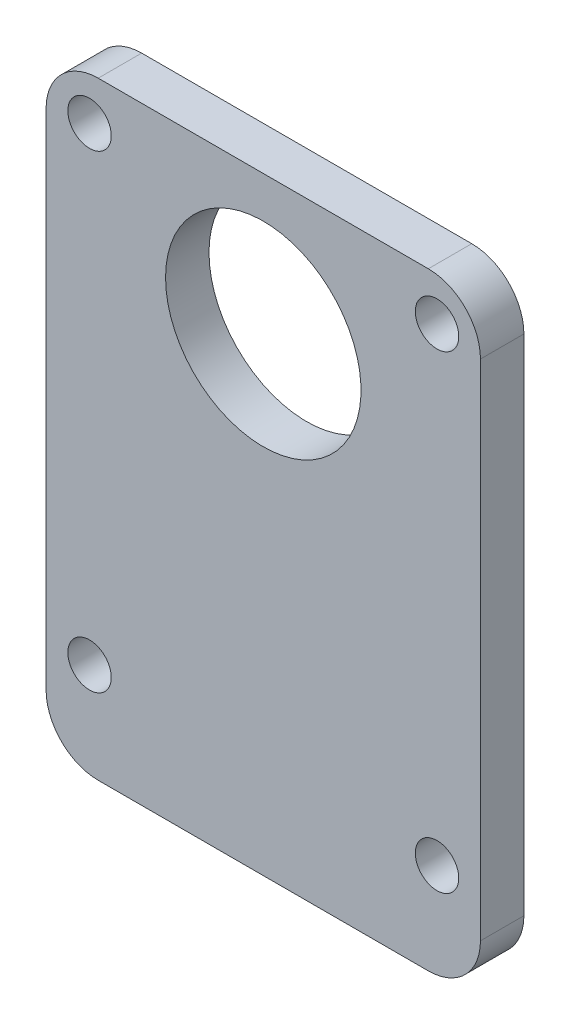
from build123d import *

# Parameters (mm, degrees)
BOSS_EXTRUDE1_DEPTH = 6.35
SKETCH2_R           = 1.35
SKETCH2_R_2         = 1.385
CUT_EXTRUDE1_DEPTH  = 38.116505762
SKETCH3_W           = 63.5
SKETCH3_H           = 88.9
SKETCH3_W_2         = 38.321076004
SKETCH3_H_2         = 47.237540142
BOSS_EXTRUDE2_DEPTH = 6.35
SKETCH5_W           = 27.94
SKETCH5_H           = 55.88
CUT_EXTRUDE3_DEPTH  = 61.153053743
SKETCH6_R           = 3.175
CUT_EXTRUDE4_DEPTH  = 61.153053743
FILLET2_R           = 7.62
SKETCH7_W           = 41.724968974
SKETCH7_H           = 57.858351452
BOSS_EXTRUDE3_DEPTH = 6.35
SKETCH8_R           = 14.2875
CUT_EXTRUDE5_DEPTH  = 6.35


with BuildPart() as part:
    # Sketch1 → Boss-Extrude1 (new body)
    with BuildSketch(Plane.XY):
        with BuildLine():
            Line((-19.69889026, 23.2987845), (-14.850045261, 29.75147823))
            ThreePointArc((-14.850045261, 29.75147823), (-14.144755454, 30.339267512), (-13.251155001, 30.55))
            Line((-13.251155001, 30.55), (13.251155001, 30.55))
            ThreePointArc((13.251155001, 30.55), (14.144755454, 30.339267512), (14.850045261, 29.75147823))
            Line((14.850045261, 29.75147823), (19.69889026, 23.2987845))
            ThreePointArc((19.69889026, 23.2987845), (19.997074131, 22.730638521), (20.1, 22.09730627))
            Line((20.1, 22.09730627), (20.1, -22.09730627))
            ThreePointArc((20.1, -22.09730627), (19.997074131, -22.730638521), (19.69889026, -23.2987845))
            Line((19.69889026, -23.2987845), (14.850045261, -29.75147823))
            ThreePointArc((14.850045261, -29.75147823), (14.144755454, -30.339267512), (13.251155001, -30.55))
            Line((13.251155001, -30.55), (-13.251155001, -30.55))
            ThreePointArc((-13.251155001, -30.55), (-14.144755454, -30.339267512), (-14.850045261, -29.75147823))
            Line((-14.850045261, -29.75147823), (-19.69889026, -23.2987845))
            ThreePointArc((-19.69889026, -23.2987845), (-19.997074131, -22.730638521), (-20.1, -22.09730627))
            Line((-20.1, -22.09730627), (-20.1, 22.09730627))
            ThreePointArc((-20.1, 22.09730627), (-19.997074131, 22.730638521), (-19.69889026, 23.2987845))
        make_face()
    extrude(amount=-BOSS_EXTRUDE1_DEPTH)

    # Sketch2 → Cut-Extrude1 (cut, through all)
    with BuildSketch(Plane(origin=(0, 0, -6.35), x_dir=(-1, 0, 0), z_dir=(0, 0, -1))):
        with Locations((17.3, 21.9487845)):
            Circle(SKETCH2_R)
        with Locations((17.3, -0.0512155)):
            Circle(SKETCH2_R)
        with Locations((17.3, -22.0512155)):
            Circle(SKETCH2_R)
        with Locations((11, -27.75)):
            Circle(SKETCH2_R_2)
        with Locations(Location((-11, -27.75, 0), (0, 0, 180))):
            Circle(SKETCH2_R_2)
        with Locations(Location((-17.3, -22.0512155, 0), (0, 0, 180))):
            Circle(SKETCH2_R)
        with Locations(Location((-17.3, -0.0512155, 0), (0, 0, 180))):
            Circle(SKETCH2_R)
        with Locations(Location((-17.3, 21.9487845, 0), (0, 0, 180))):
            Circle(SKETCH2_R)
    extrude(amount=-CUT_EXTRUDE1_DEPTH, mode=Mode.SUBTRACT)

    # Sketch3 → Boss-Extrude2 (add)
    with BuildSketch(Plane(origin=(0, 0, -6.35), x_dir=(-1, 0, 0), z_dir=(0, 0, -1))):
        with Locations((0, -6.2452155)):
            Rectangle(SKETCH3_W, SKETCH3_H)
        Rectangle(SKETCH3_W_2, SKETCH3_H_2, mode=Mode.SUBTRACT)
    extrude(amount=-BOSS_EXTRUDE2_DEPTH)

    # Sketch5 → Cut-Extrude3 (cut, through all)
    with BuildSketch(Plane.XY):
        with Locations((0, 3.0087845)):
            Rectangle(SKETCH5_W, SKETCH5_H)
    extrude(amount=-CUT_EXTRUDE3_DEPTH, mode=Mode.SUBTRACT)

    # Sketch6 → Cut-Extrude4 (cut, through all)
    with BuildSketch(Plane(origin=(0, 0, -6.35), x_dir=(-1, 0, 0), z_dir=(0, 0, -1))):
        with Locations((25.4, 31.8547845)):
            Circle(SKETCH6_R)
        with Locations((-25.4, 31.8547845)):
            Circle(SKETCH6_R)
        with Locations((-25.4, -36.7252155)):
            Circle(SKETCH6_R)
        with Locations((25.4, -36.7252155)):
            Circle(SKETCH6_R)
    extrude(amount=-CUT_EXTRUDE4_DEPTH, mode=Mode.SUBTRACT)

    # Fillet2
    fillet2_edges = [part.edges().sort_by_distance(p)[0] for p in [
        (-31.75, 38.2047845, -3.175),
        (-31.75, -50.6952155, -3.175),
        (31.75, -50.6952155, -3.175),
        (31.75, 38.2047845, -3.175),
    ]]
    fillet(fillet2_edges, radius=FILLET2_R)

    # Sketch7 → Boss-Extrude3 (add)
    with BuildSketch(Plane(origin=(0, 0, -6.35), x_dir=(-1, 0, 0), z_dir=(0, 0, -1))):
        with Locations((0, 3.16744248)):
            Rectangle(SKETCH7_W, SKETCH7_H)
    extrude(amount=-BOSS_EXTRUDE3_DEPTH)

    # Sketch8 → Cut-Extrude5 (cut)
    with BuildSketch(Plane(origin=(0, 0, -6.35), x_dir=(-1, 0, 0), z_dir=(0, 0, -1))):
        with Locations((0, 17.8847845)):
            Circle(SKETCH8_R)
    extrude(amount=-CUT_EXTRUDE5_DEPTH, mode=Mode.SUBTRACT)


solid = part.part
